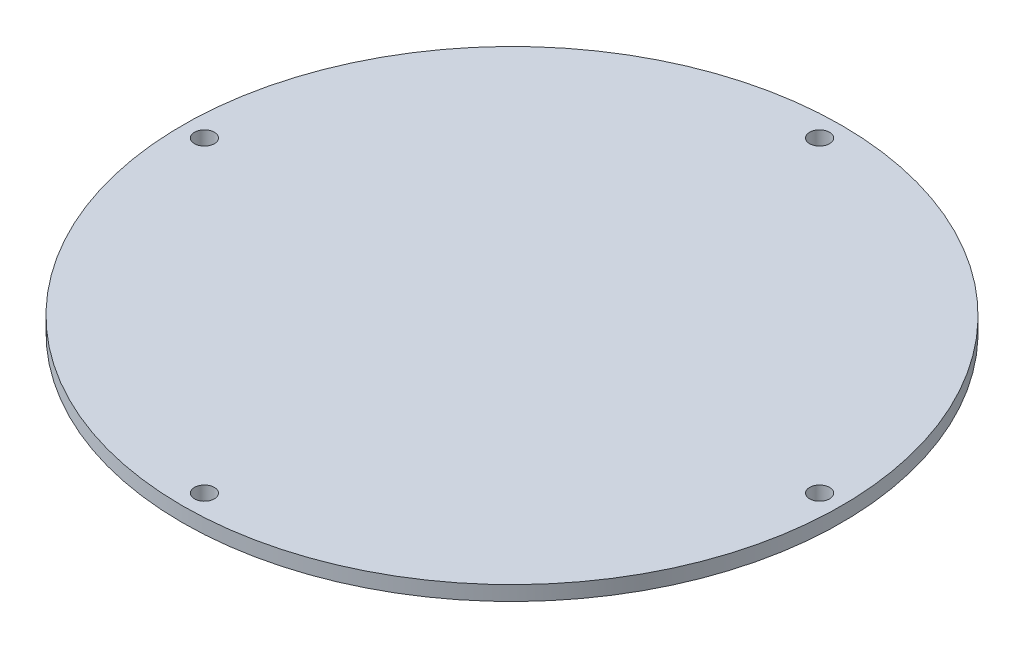
from build123d import *

# Parameters (mm, degrees)
SKETCH1_R             = 57.15
BOSS_EXTRUDE1_DEPTH   = 2.54
F_8_32_TAPPED_HOLE1_D = 3.4544
CIRPATTERN2_COUNT     = 4


with BuildPart() as part:
    # Sketch1 → Boss-Extrude1 (new body)
    with BuildSketch(Plane(origin=(0, 0, 0), x_dir=(1, 0, 0), z_dir=(0, 1, 0))):
        with Locations(Location((0, 0, 0), (0, 0, 270))):
            Circle(SKETCH1_R)
    extrude(amount=BOSS_EXTRUDE1_DEPTH)

    # #8-32 Tapped Hole1 (through all)
    with Locations(Plane(origin=(0, 2.54, 0), x_dir=(1, 0, 0), z_dir=(0, 1, 0))):
        with Locations((-53.34, 0)):
            f_8_32_tapped_hole1 = Hole(F_8_32_TAPPED_HOLE1_D / 2)

    # CirPattern2: #8-32 Tapped Hole1 ×4 about axis
    cirpattern2_axis = Axis((0, 0, 0), (0, 1, 0))
    for i in range(1, CIRPATTERN2_COUNT):
        add(f_8_32_tapped_hole1.rotate(cirpattern2_axis, i * 360 / CIRPATTERN2_COUNT), mode=Mode.SUBTRACT)


solid = part.part
